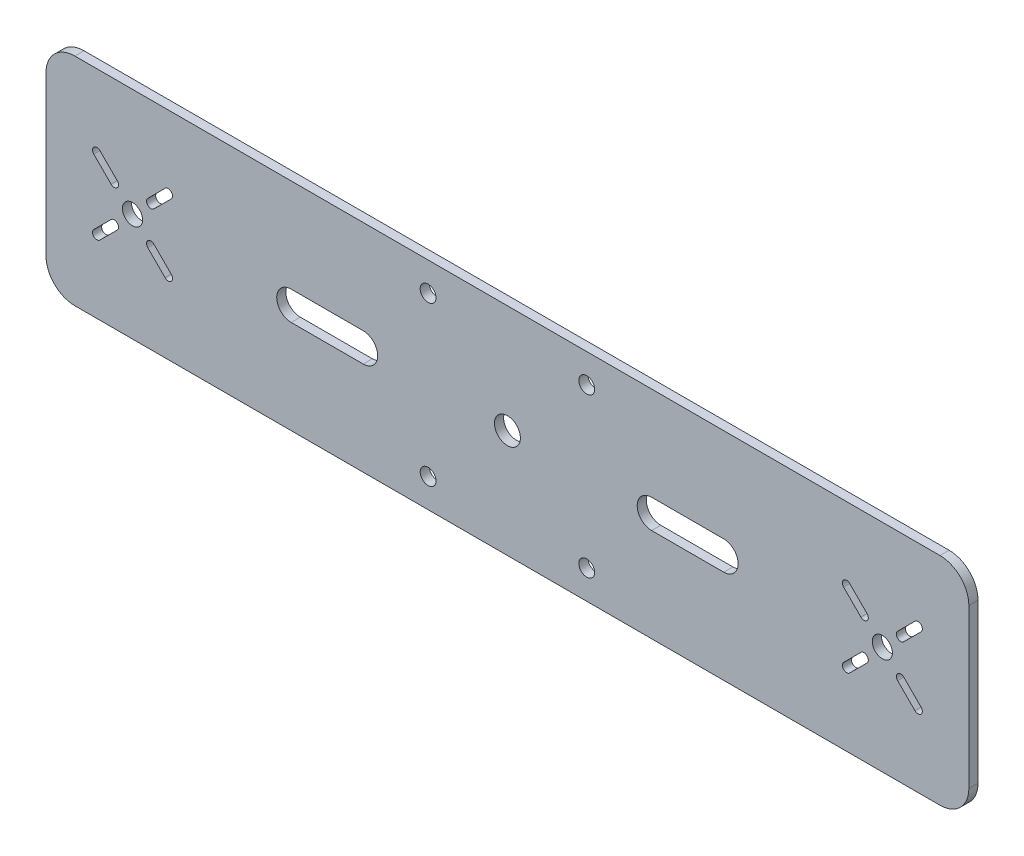
from build123d import *

# Parameters (mm, degrees)
SKETCH1_W                       = 320
SKETCH1_H                       = 75
SKETCH1_R                       = 4.5
SKETCH1_R_2                     = 2.75
SKETCH1_R_3                     = 3.5
BOSS_EXTRUDE1_DEPTH             = 3.175
MOUNTING_AND_ACCESS_HOLES_DEPTH = 356.015056899
FILLET1_R                       = 10


with BuildPart() as part:
    # Sketch1 → Boss-Extrude1 (new body)
    with BuildSketch(Plane.XY.offset(151.125)):
        with Locations((0, 279.4)):
            Rectangle(SKETCH1_W, SKETCH1_H)
        with Locations((0, 279.4)):
            Circle(SKETCH1_R, mode=Mode.SUBTRACT)
        with Locations((27.5, 251.9)):
            Circle(SKETCH1_R_2, mode=Mode.SUBTRACT)
        with Locations((-27.5, 251.9)):
            Circle(SKETCH1_R_2, mode=Mode.SUBTRACT)
        with Locations((-27.5, 306.9)):
            Circle(SKETCH1_R_2, mode=Mode.SUBTRACT)
        with Locations((27.5, 306.9)):
            Circle(SKETCH1_R_2, mode=Mode.SUBTRACT)
        with Locations((130, 279.4)):
            Circle(SKETCH1_R_3, mode=Mode.SUBTRACT)
        with Locations((-130, 279.4)):
            Circle(SKETCH1_R_3, mode=Mode.SUBTRACT)
    extrude(amount=BOSS_EXTRUDE1_DEPTH)

    # Sketch2 → Mounting and Access Holes (cut, symmetric)
    with BuildSketch(Plane.XY.offset(154.3)):
        with BuildLine():
            Line((-124.696699141, 286.824621202), (-118.686291501, 292.835028843))
            ThreePointArc((-118.686291501, 292.835028843), (-116.564971157, 292.835028843), (-116.564971157, 290.713708499))
            Line((-116.564971157, 290.713708499), (-122.575378798, 284.703300859))
            ThreePointArc((-122.575378798, 284.703300859), (-124.696699141, 284.703300859), (-124.696699141, 286.824621202))
        make_face()
        with BuildLine():
            Line((-135.303300859, 286.824621202), (-141.313708499, 292.835028843))
            ThreePointArc((-141.313708499, 292.835028843), (-143.435028843, 292.835028843), (-143.435028843, 290.713708499))
            Line((-143.435028843, 290.713708499), (-137.424621202, 284.703300859))
            ThreePointArc((-137.424621202, 284.703300859), (-135.303300859, 284.703300859), (-135.303300859, 286.824621202))
        make_face()
        with BuildLine():
            Line((-137.424621202, 274.096699141), (-143.435028843, 268.086291501))
            ThreePointArc((-143.435028843, 268.086291501), (-143.435028843, 265.964971157), (-141.313708499, 265.964971157))
            Line((-141.313708499, 265.964971157), (-135.303300859, 271.975378798))
            ThreePointArc((-135.303300859, 271.975378798), (-135.303300859, 274.096699141), (-137.424621202, 274.096699141))
        make_face()
        with BuildLine():
            Line((-124.696699141, 271.975378798), (-118.686291501, 265.964971157))
            ThreePointArc((-118.686291501, 265.964971157), (-116.564971157, 265.964971157), (-116.564971157, 268.086291501))
            Line((-116.564971157, 268.086291501), (-122.575378798, 274.096699141))
            ThreePointArc((-122.575378798, 274.096699141), (-124.696699141, 274.096699141), (-124.696699141, 271.975378798))
        make_face()
        with BuildLine():
            Line((-50, 274.4), (-75, 274.4))
            ThreePointArc((-75, 274.4), (-80, 279.4), (-75, 284.4))
            Line((-75, 284.4), (-50, 284.4))
            ThreePointArc((-50, 284.4), (-45, 279.4), (-50, 274.4))
        make_face()
    mounting_and_access_holes = extrude(amount=MOUNTING_AND_ACCESS_HOLES_DEPTH, both=True, mode=Mode.SUBTRACT)

    # Mirror1: Mounting and Access Holes across plane
    add(mounting_and_access_holes.mirror(Plane(origin=(0, 0, 0), x_dir=(0, 0, 1), z_dir=(1, 0, 0))), mode=Mode.SUBTRACT)

    # Fillet1
    fillet1_edges = [part.edges().sort_by_distance(p)[0] for p in [
        (160, 241.9, 152.7125),
        (-160, 241.9, 152.7125),
        (-160, 316.9, 152.7125),
        (160, 316.9, 152.7125),
    ]]
    fillet(fillet1_edges, radius=FILLET1_R)


solid = part.part
